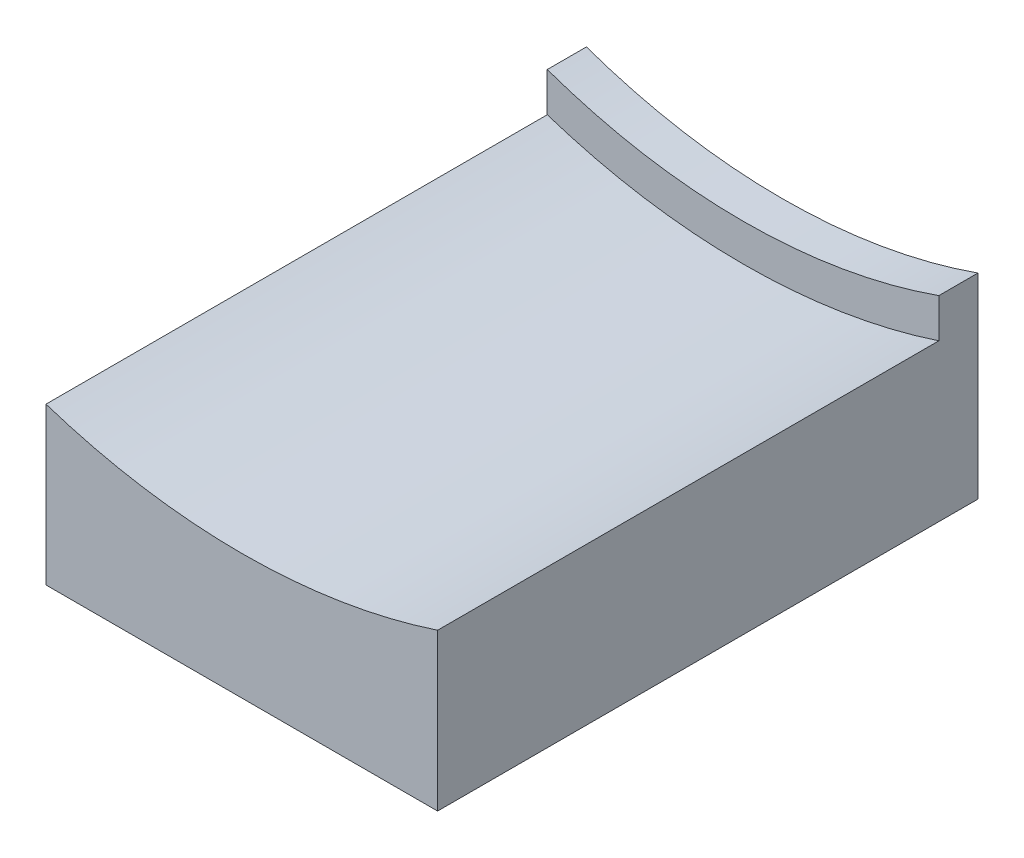
from build123d import *

# Parameters (mm, degrees)
BOSS_EXTRUDE1_DEPTH = 64
BOSS_EXTRUDE2_DEPTH = 5


with BuildPart() as part:
    # Sketch3 → Boss-Extrude1 (new body)
    with BuildSketch(Plane.XY):
        with BuildLine():
            Line((0, 0), (50, 0))
            Line((50, 0), (50, 20))
            ThreePointArc((50, 20), (25, 15.993420768), (0, 20))
            Line((0, 20), (0, 0))
        make_face()
    extrude(amount=BOSS_EXTRUDE1_DEPTH)

    # Sketch4 → Boss-Extrude2 (add)
    with BuildSketch(Plane(origin=(0, 0, 0), x_dir=(-1, 0, 0), z_dir=(0, 0, -1))):
        with BuildLine():
            Line((-50, 0), (0, 0))
            Line((0, 0), (0, 25))
            ThreePointArc((0, 25), (-25, 20.726789434), (-50, 25))
            Line((-50, 25), (-50, 0))
        make_face()
    extrude(amount=BOSS_EXTRUDE2_DEPTH)


solid = part.part
